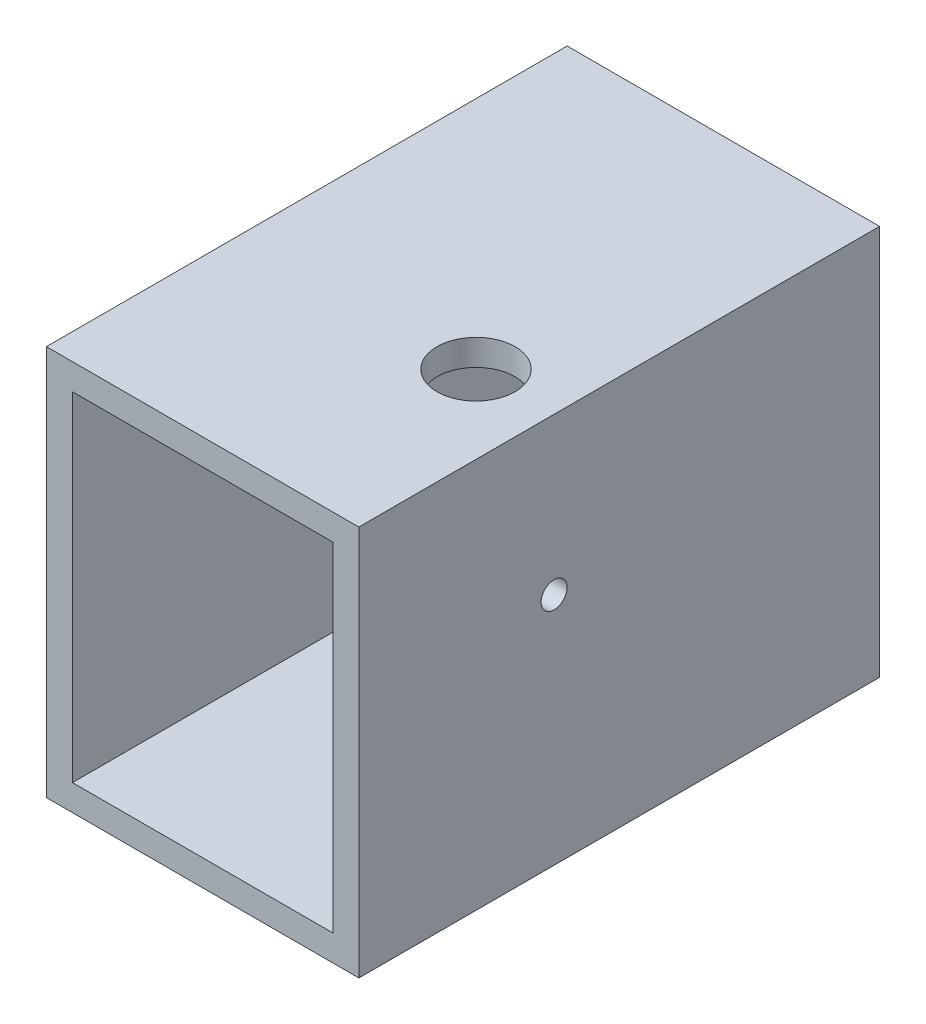
from build123d import *

# Parameters (mm, degrees)
SKETCH1_W           = 120
SKETCH1_H           = 150
BOSS_EXTRUDE1_DEPTH = 200
SKETCH2_W           = 100
SKETCH2_H           = 130
CUT_EXTRUDE1_DEPTH  = 195
SKETCH3_R           = 5
CUT_EXTRUDE2_DEPTH  = 120
CUT_EXTRUDE3_START  = -130
SKETCH4_R           = 15
CUT_EXTRUDE3_DEPTH  = 24


with BuildPart() as part:
    # Sketch1 → Boss-Extrude1 (new body)
    with BuildSketch(Plane.XY):
        with Locations((60, -75)):
            Rectangle(SKETCH1_W, SKETCH1_H)
    extrude(amount=BOSS_EXTRUDE1_DEPTH)

    # Sketch2 → Cut-Extrude1 (cut)
    with BuildSketch(Plane.XY.offset(200)):
        with Locations((60, -75)):
            Rectangle(SKETCH2_W, SKETCH2_H)
    extrude(amount=-CUT_EXTRUDE1_DEPTH, mode=Mode.SUBTRACT)

    # Sketch3 → Cut-Extrude2 (cut)
    with BuildSketch(Plane(origin=(120, 0, 0), x_dir=(0, 0, -1), z_dir=(1, 0, 0))):
        with Locations(Location((-125, -60, 0), (0, 0, 90))):
            Circle(SKETCH3_R)
    extrude(amount=-CUT_EXTRUDE2_DEPTH, mode=Mode.SUBTRACT)

    # Sketch4 → Cut-Extrude3 (cut)
    with BuildSketch(Plane.XZ.offset(150).offset(CUT_EXTRUDE3_START)):
        with Locations(Location((90, 125, 0), (0, 0, 270))):
            Circle(SKETCH4_R)
    extrude(amount=-CUT_EXTRUDE3_DEPTH, mode=Mode.SUBTRACT)


solid = part.part
